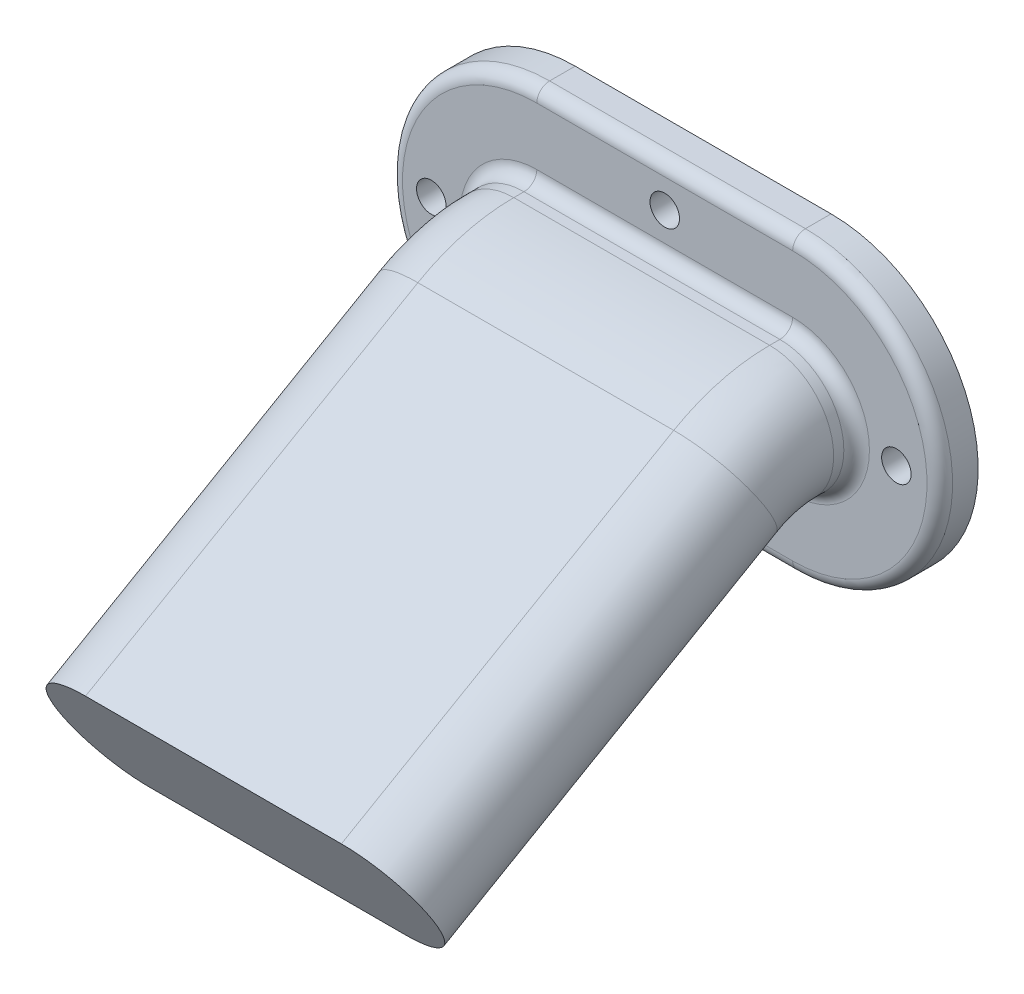
from build123d import *

# Parameters (mm, degrees)
SKETCH9_R      = 2.928820999
EXTRUDE2_DEPTH = 7.62
FILLET3_R      = 2.54


with BuildPart() as part:
    # Sweep5: sweep along a path in Sketch1
    with BuildLine(Plane(origin=(0, 0, 0), x_dir=(0, 0, -1), z_dir=(1, 0, 0))) as sweep5_path:
        Line((0, 0), (65.991135768, 38.1))
        ThreePointArc((65.991135768, 38.1), (72.117132023, 40.637470732), (78.691135768, 41.502954744))
        Line((78.691135768, 41.502954744), (90.878802907, 41.502954744))
    # Sketch2 → Sweep5 (sweep)
    with BuildSketch(Plane(origin=(0, 0, 0), x_dir=(-1, 0, 0), z_dir=(0, 0.5000000000000013, -0.8660254037844379))):
        with BuildLine():
            Line((-25.4, 12.7), (25.4, 12.7))
            ThreePointArc((25.4, 12.7), (38.1, 0), (25.4, -12.7))
            Line((25.4, -12.7), (-25.4, -12.7))
            ThreePointArc((-25.4, -12.7), (-38.1, 0), (-25.4, 12.7))
        make_face()
    sweep(path=sweep5_path.line)

    # Sketch9 → Extrude2 (add)
    with BuildSketch(Plane(origin=(0, 0, -90.878802907), x_dir=(-1, 0, 0), z_dir=(0, 0, -1))):
        with BuildLine():
            Line((-25.4, 70.712954744), (25.4, 70.712954744))
            ThreePointArc((25.4, 70.712954744), (54.61, 41.502954744), (25.4, 12.292954744))
            Line((25.4, 12.292954744), (-25.4, 12.292954744))
            ThreePointArc((-25.4, 12.292954744), (-54.61, 41.502954744), (-25.4, 70.712954744))
        make_face()
        with Locations(Location((-45.990959388, 41.502954744, 0), (0, 0, 90))):
            Circle(SKETCH9_R, mode=Mode.SUBTRACT)
        with Locations(Location((0, 62.457954744, 0), (0, 0, 90))):
            Circle(SKETCH9_R, mode=Mode.SUBTRACT)
        with Locations(Location((46.355, 41.502954744, 0), (0, 0, 90))):
            Circle(SKETCH9_R, mode=Mode.SUBTRACT)
        with Locations(Location((0, 20.547954744, 0), (0, 0, 90))):
            Circle(SKETCH9_R, mode=Mode.SUBTRACT)
        with BuildLine():
            Line((-25.4, 54.202954744), (25.4, 54.202954744))
            ThreePointArc((25.4, 54.202954744), (38.1, 41.502954744), (25.4, 28.802954744))
            Line((25.4, 28.802954744), (-25.4, 28.802954744))
            ThreePointArc((-25.4, 28.802954744), (-38.1, 41.502954744), (-25.4, 54.202954744))
        make_face(mode=Mode.SUBTRACT)
    extrude(amount=-EXTRUDE2_DEPTH)

    # Fillet3
    fillet3_edges = [part.edges().sort_by_distance(p)[0] for p in [
        (54.61, 41.502954744, -83.258802907),
        (0, 70.712954744, -83.258802907),
        (-54.61, 41.502954744, -83.258802907),
        (0, 12.292954744, -83.258802907),
        (38.1, 41.502954744, -83.258802907),
        (0, 28.802954744, -83.258802907),
        (-38.1, 41.502954744, -83.258802907),
        (0, 54.202954744, -83.258802907),
    ]]
    fillet(fillet3_edges, radius=FILLET3_R)


solid = part.part
